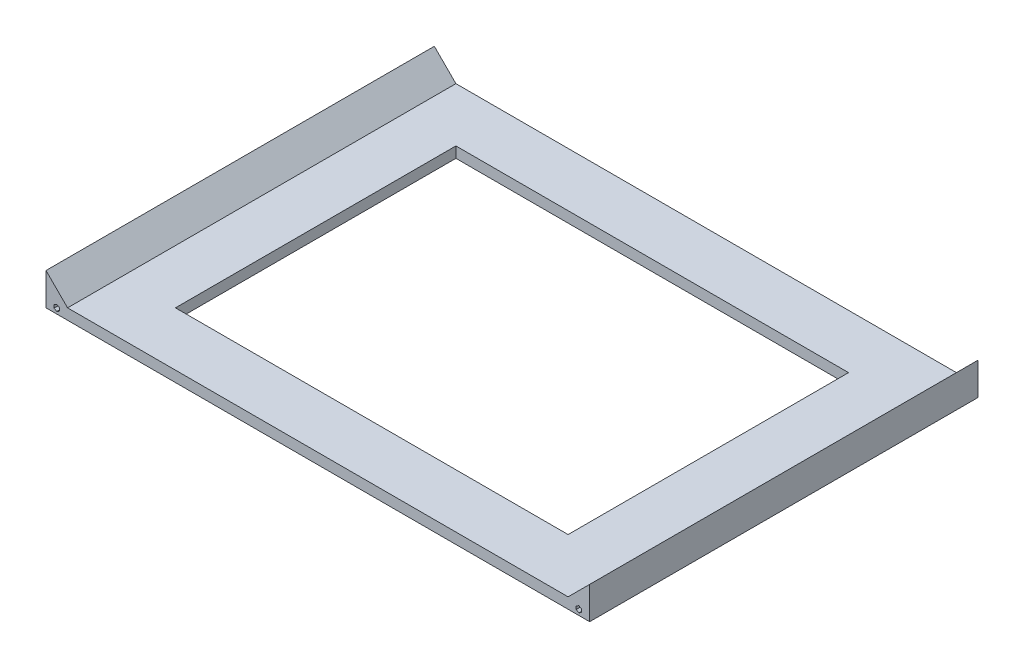
from build123d import *

# Parameters (mm, degrees)
BOSS_EXTRUDE1_DEPTH      = 90
BOSS_EXTRUDE1_DEPTH_BACK = 90
CUT_EXTRUDE1_DEPTH       = 221.229425827
SKETCH5_W                = 182
SKETCH5_H                = 130
CUT_EXTRUDE3_DEPTH       = 156.164428913


with BuildPart() as part:
    # Sketch1 → Boss-Extrude1 (new, two sides: drawn at the far end of the back side and taken through both)
    with BuildSketch(Plane.XY.offset(-BOSS_EXTRUDE1_DEPTH_BACK)):
        Polygon((-126, 0), (126, 0), (126, 15), (116, 5), (-116, 5), (-126, 15), align=None)
    extrude(amount=BOSS_EXTRUDE1_DEPTH + BOSS_EXTRUDE1_DEPTH_BACK)

    # Sketch3 → Cut-Extrude1 (cut, through all)
    with BuildSketch(Plane.XY.offset(90)):
        Polygon((-121, 3.943375673), (-122.25, 3.221687836), (-122.25, 1.778312164), (-121, 1.056624327), (-119.75, 1.778312164), (-119.75, 3.221687836), align=None)
        Polygon((119.75, 3.221687836), (121, 3.943375673), (122.25, 3.221687836), (122.25, 1.778312164), (121, 1.056624327), (119.75, 1.778312164), align=None)
    extrude(amount=-CUT_EXTRUDE1_DEPTH, mode=Mode.SUBTRACT)

    # Sketch5 → Cut-Extrude3 (cut, through all)
    with BuildSketch(Plane(origin=(0, 5, 0), x_dir=(1, 0, 0), z_dir=(0, 1, 0))):
        Rectangle(SKETCH5_W, SKETCH5_H)
    extrude(amount=-CUT_EXTRUDE3_DEPTH, mode=Mode.SUBTRACT)


solid = part.part
